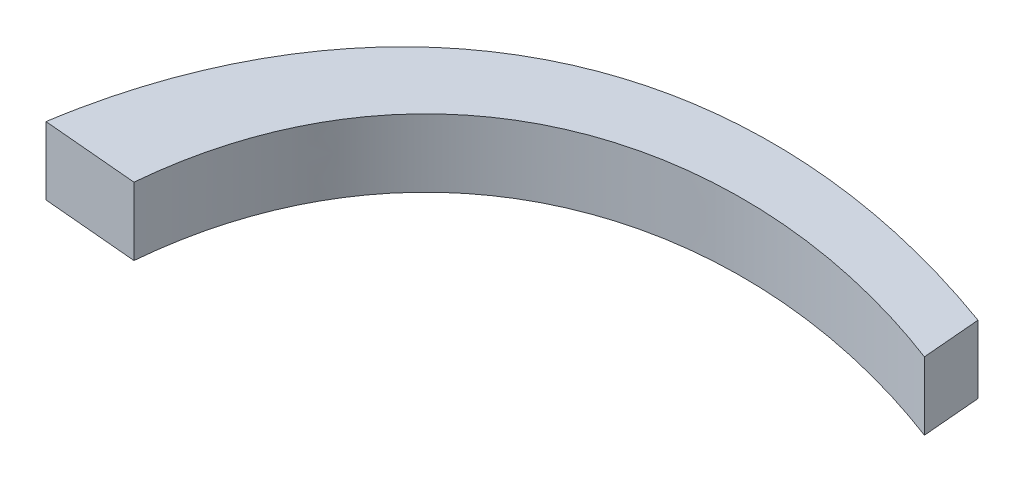
from build123d import *

# Parameters (mm, degrees)
BOSS_EXTRUDE1_DEPTH = 19
SCALE1_SCALE        = 0.5


with BuildPart() as part:
    # Sketch1 → Boss-Extrude1 (new body)
    with BuildSketch(Plane(origin=(0, 0, 0), x_dir=(1, 0, 0), z_dir=(0, 1, 0))):
        with BuildLine():
            Line((0, 0), (-26.995391357, 2.384864734))
            add(Edge.make_bspline(
                [(-26.995391357, 2.384864734), (-15.184205607, 78.225184909), (44.206971658, 123.490073632), (151.540763876, 84.657568149)],
                knots=[0, 0, 0, 0, 1, 1, 1, 1], degree=3))
            Line((151.540763876, 84.657568149), (152.932112852, 68.275895853))
            add(Edge.make_bspline(
                [(0, 0), (6.711010618, 75.965045512), (73.686450741, 98.332442943), (152.932112852, 68.275895853)],
                knots=[0, 0, 0, 0, 1, 1, 1, 1], degree=3))
        make_face()
    extrude(amount=BOSS_EXTRUDE1_DEPTH)


with BuildPart() as part_1:
    # Scale1: scaled about (44.348424998, 9.5, -63.472666271)
    add(part.part.scale(SCALE1_SCALE).moved(Location((22.174212499, 4.75, -31.736333136))))


solid = part_1.part
